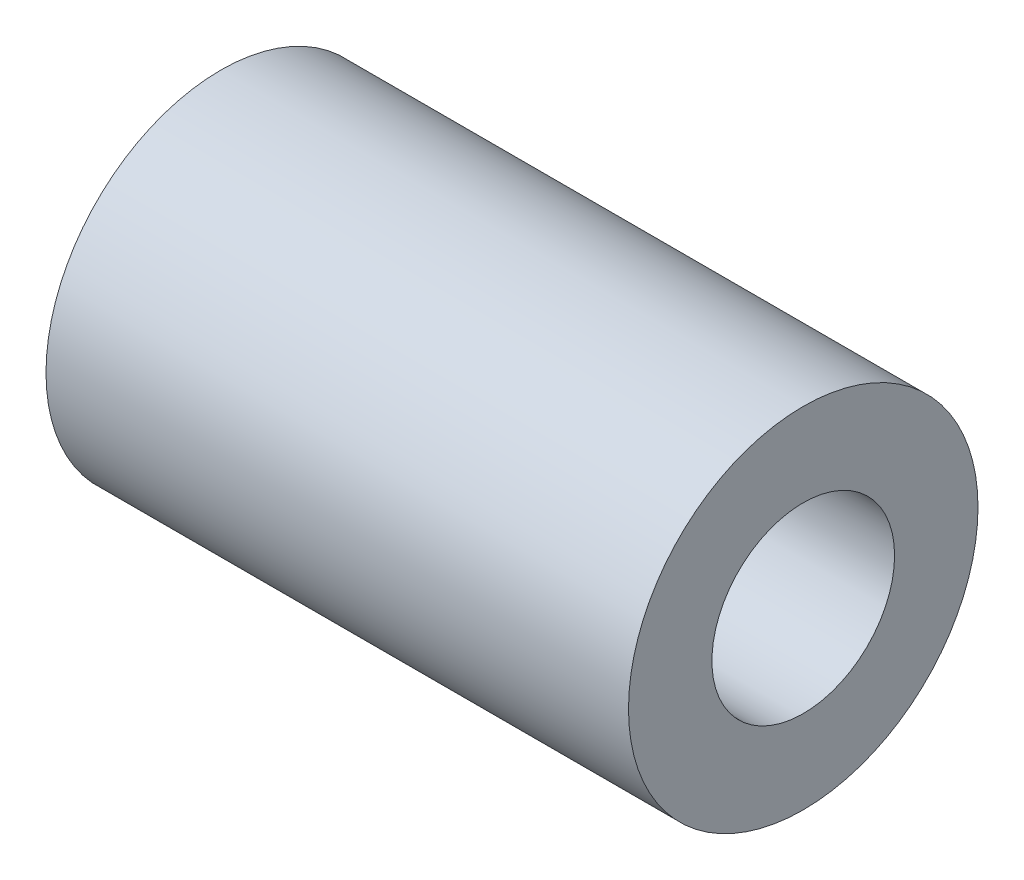
from build123d import *

# Parameters (mm, degrees)
SKETCH1_R           = 4.7625
SKETCH1_R_2         = 2.4892
BOSS_EXTRUDE1_DEPTH = 15.875


with BuildPart() as part:
    # Sketch1 → Boss-Extrude1 (new body)
    with BuildSketch(Plane(origin=(0, 0, 0), x_dir=(0, 0, -1), z_dir=(1, 0, 0))):
        Circle(SKETCH1_R)
        Circle(SKETCH1_R_2, mode=Mode.SUBTRACT)
    extrude(amount=BOSS_EXTRUDE1_DEPTH)


solid = part.part
